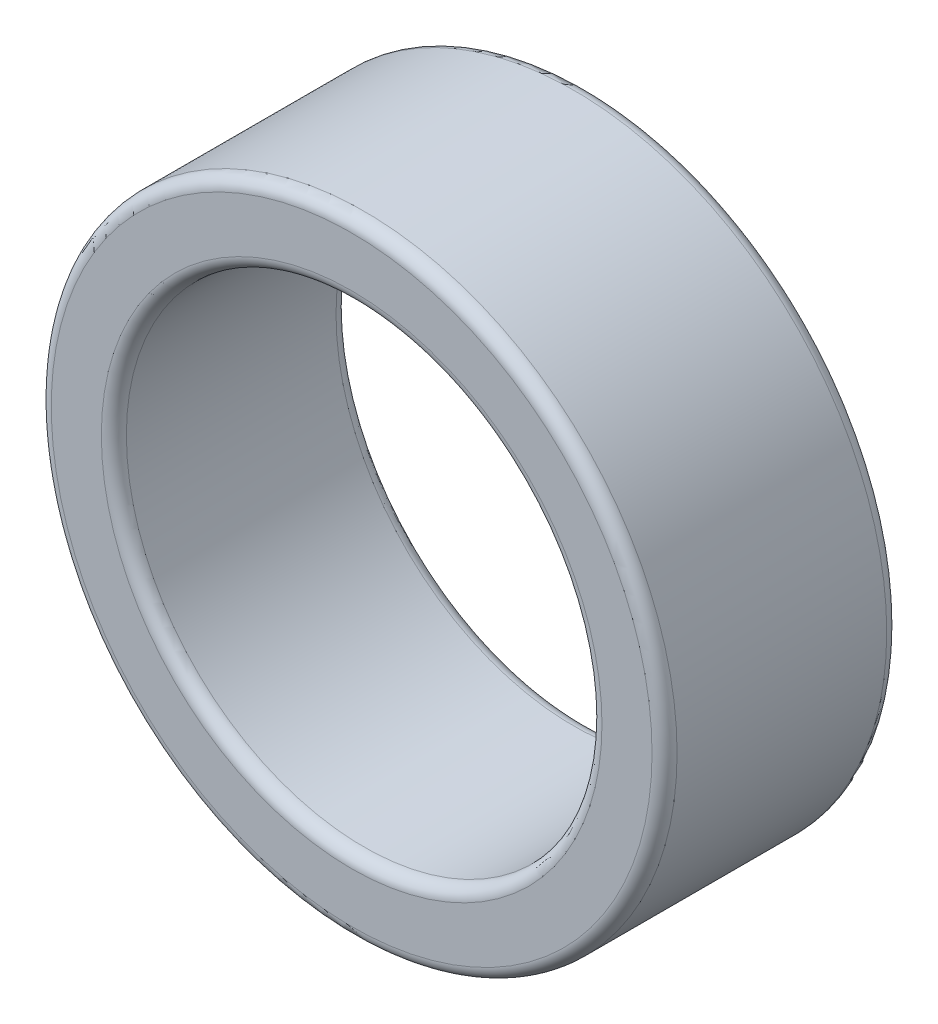
from build123d import *

# Parameters (mm, degrees)
SKETCH1_R           = 12.7
SKETCH1_R_2         = 9.652
BOSS_EXTRUDE1_DEPTH = 9.525
FILLET1_R           = 0.508


with BuildPart() as part:
    # Sketch1 → Boss-Extrude1 (new body)
    with BuildSketch(Plane.XY):
        with Locations(Location((0, 0, 0), (0, 0, 180))):
            Circle(SKETCH1_R)
        with Locations(Location((0, 0, 0), (0, 0, 180))):
            Circle(SKETCH1_R_2, mode=Mode.SUBTRACT)
    extrude(amount=BOSS_EXTRUDE1_DEPTH)

    # Fillet1
    fillet1_edges = [part.edges().sort_by_distance(p)[0] for p in [
        (12.7, 0, 0),
        (12.7, 0, 9.525),
        (9.652, 0, 0),
        (9.652, 0, 9.525),
    ]]
    fillet(fillet1_edges, radius=FILLET1_R)


solid = part.part
